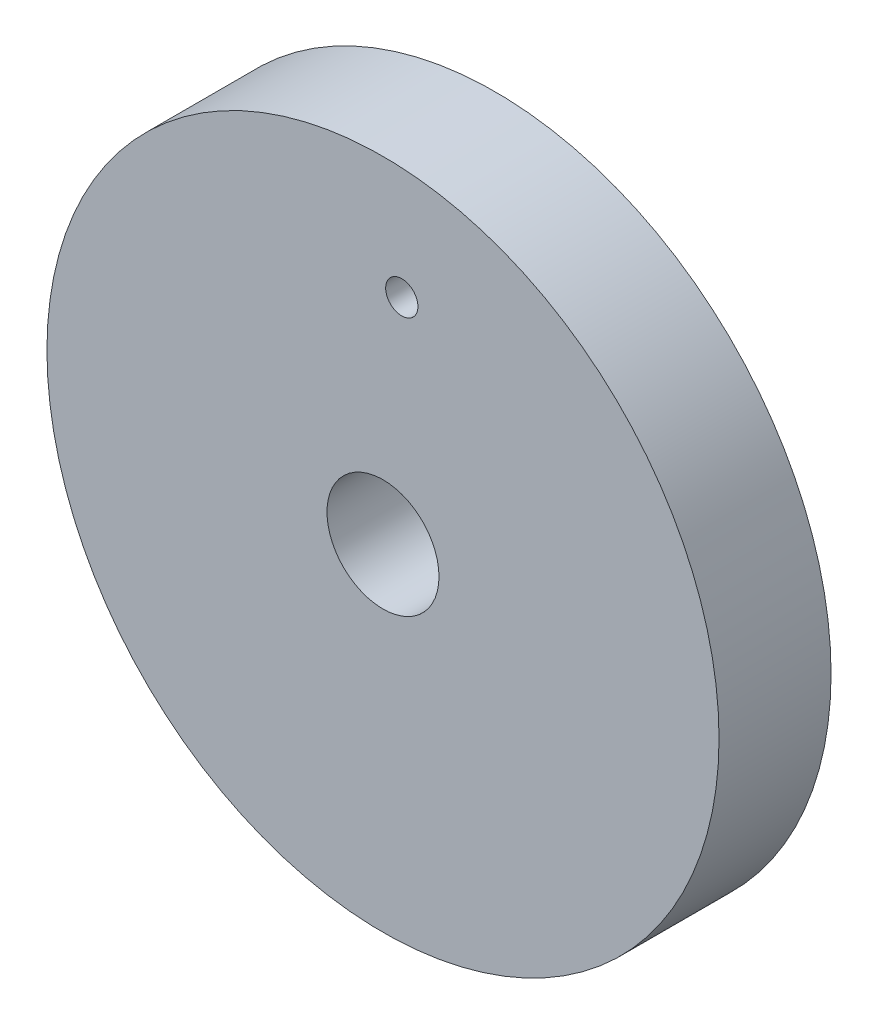
from build123d import *

# Parameters (mm, degrees)
SKETCH1_R           = 38.1
SKETCH1_R_2         = 6.35
BOSS_EXTRUDE1_DEPTH = 12.7
SKETCH2_R           = 1.828642627
CUT_EXTRUDE1_DEPTH  = 56.358016583


with BuildPart() as part:
    # Sketch1 → Boss-Extrude1 (new body)
    with BuildSketch(Plane.XY):
        Circle(SKETCH1_R)
        Circle(SKETCH1_R_2, mode=Mode.SUBTRACT)
    extrude(amount=BOSS_EXTRUDE1_DEPTH)

    # Sketch2 → Cut-Extrude1 (cut, through all)
    with BuildSketch(Plane.XY.offset(12.7)):
        with Locations((2.130416087, 25.31962512)):
            Circle(SKETCH2_R)
    extrude(amount=-CUT_EXTRUDE1_DEPTH, mode=Mode.SUBTRACT)


solid = part.part
